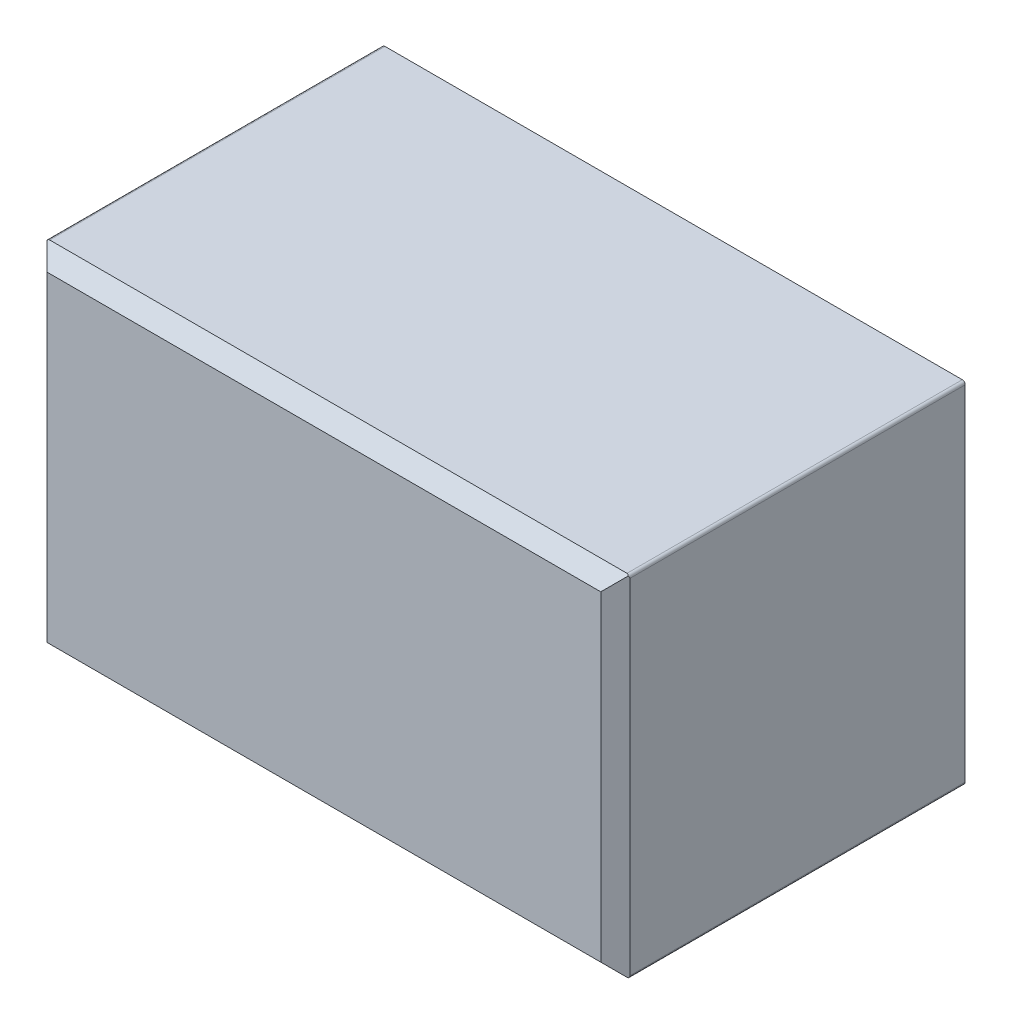
from build123d import *

# Parameters (mm, degrees)
SKETCH1_W           = 2
SKETCH1_H           = 1.2
BOSS_EXTRUDE1_DEPTH = 1.2
CHAMFER1_SIZE       = 0.05
FILLET1_R           = 0.01


with BuildPart() as part:
    # Sketch1 → Boss-Extrude1 (new body)
    with BuildSketch(Plane.XY):
        with Locations((-0.068421053, 0.081578947)):
            Rectangle(SKETCH1_W, SKETCH1_H)
    extrude(amount=BOSS_EXTRUDE1_DEPTH)

    # Chamfer1
    chamfer1_edges = [part.edges().sort_by_distance(p)[0] for p in [
        (0.931578947, 0.081578947, 1.2),
        (-0.068421053, 0.681578947, 1.2),
        (-1.068421053, 0.081578947, 1.2),
        (-0.068421053, -0.518421053, 1.2),
    ]]
    chamfer(chamfer1_edges, length=CHAMFER1_SIZE)

    # Fillet1
    fillet1_edges = [part.edges().sort_by_distance(p)[0] for p in [
        (0.931578947, 0.681578947, 0.575),
        (0.931578947, -0.518421053, 0.575),
        (-1.068421053, 0.681578947, 0.575),
        (-1.068421053, -0.518421053, 0.575),
    ]]
    fillet(fillet1_edges, radius=FILLET1_R)


solid = part.part
